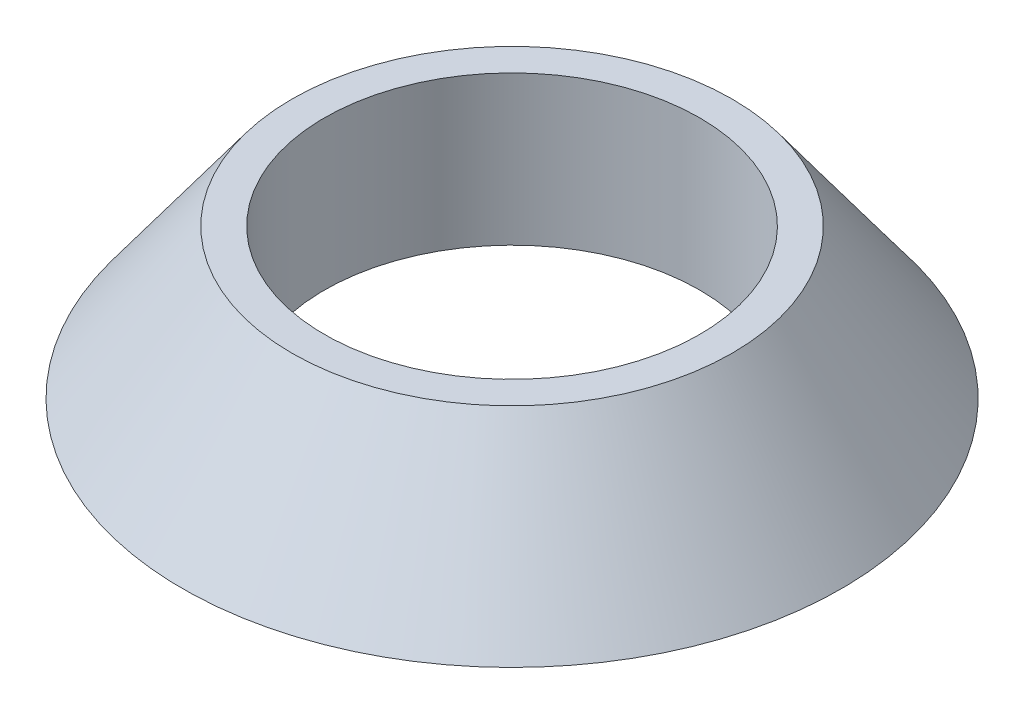
from build123d import *


with BuildPart() as part:
    # Esquisse1 → Révolution1 (revolve)
    with BuildSketch(Plane.XY, mode=Mode.PRIVATE) as r_volution1_sk:
        Polygon((20.768692793, 0), (20.768692793, 16.510874225), (24.364184029, 16.510874225), (36.4753124, 0), align=None)
    revolve(r_volution1_sk.sketch.rotate(Axis((0, 0, 0), (0, 1, 0)), 90), axis=Axis((0, 0, 0), (0, 1, 0)))


solid = part.part
